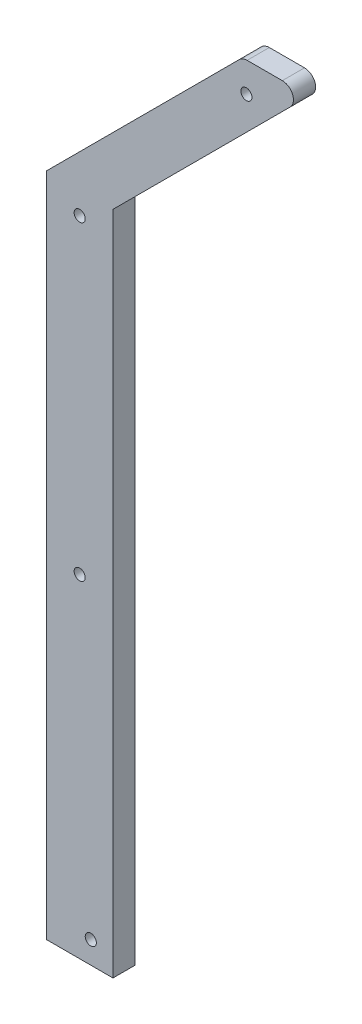
from build123d import *

# Parameters (mm, degrees)
SKETCH1_W           = 38.1
SKETCH1_H           = 381
BOSS_EXTRUDE2_DEPTH = 12.7
SKETCH3_R           = 3.175
CUT_EXTRUDE3_DEPTH  = 863.6
SKETCH4_R           = 3.175
CUT_EXTRUDE4_DEPTH  = 36
SKETCH2_R           = 3.175
CUT_EXTRUDE5_DEPTH  = 52.578
SKETCH5_R           = 3.175
CUT_EXTRUDE6_DEPTH  = 148.082


with BuildPart() as part:
    # Sketch1 → Boss-Extrude2 (new body)
    with BuildSketch(Plane.XY):
        Rectangle(SKETCH1_W, SKETCH1_H)
        with BuildLine():
            Line((19.05, 190.5), (120.463073453, 291.913073453))
            ThreePointArc((120.463073453, 291.913073453), (121.839580424, 298.833241309), (115.972945392, 302.753201513))
            Line((115.972945392, 302.753201513), (95.833457634, 302.753201513))
            ThreePointArc((95.833457634, 302.753201513), (93.403417839, 302.269836545), (91.343329574, 300.893329574))
            Line((91.343329574, 300.893329574), (-19.05, 190.5))
            Line((-19.05, 190.5), (19.05, 190.5))
        make_face()
    extrude(amount=BOSS_EXTRUDE2_DEPTH)

    # Sketch3 → Cut-Extrude3 (cut)
    with BuildSketch(Plane.XY.offset(12.7)):
        with Locations((95.396679576, 285.76176863)):
            Circle(SKETCH3_R)
    extrude(amount=-CUT_EXTRUDE3_DEPTH, mode=Mode.SUBTRACT)

    # Sketch4 → Cut-Extrude4 (cut)
    with BuildSketch(Plane.XY.offset(12.7)):
        Circle(SKETCH4_R)
    extrude(amount=-CUT_EXTRUDE4_DEPTH, mode=Mode.SUBTRACT)

    # Sketch2 → Cut-Extrude5 (cut)
    with BuildSketch(Plane.XY.offset(12.7)):
        with Locations((6.35, -177.8)):
            Circle(SKETCH2_R)
    extrude(amount=-CUT_EXTRUDE5_DEPTH, mode=Mode.SUBTRACT)

    # Sketch5 → Cut-Extrude6 (cut)
    with BuildSketch(Plane.XY.offset(12.7)):
        with Locations((0, 177.8)):
            Circle(SKETCH5_R)
    extrude(amount=-CUT_EXTRUDE6_DEPTH, mode=Mode.SUBTRACT)


solid = part.part
